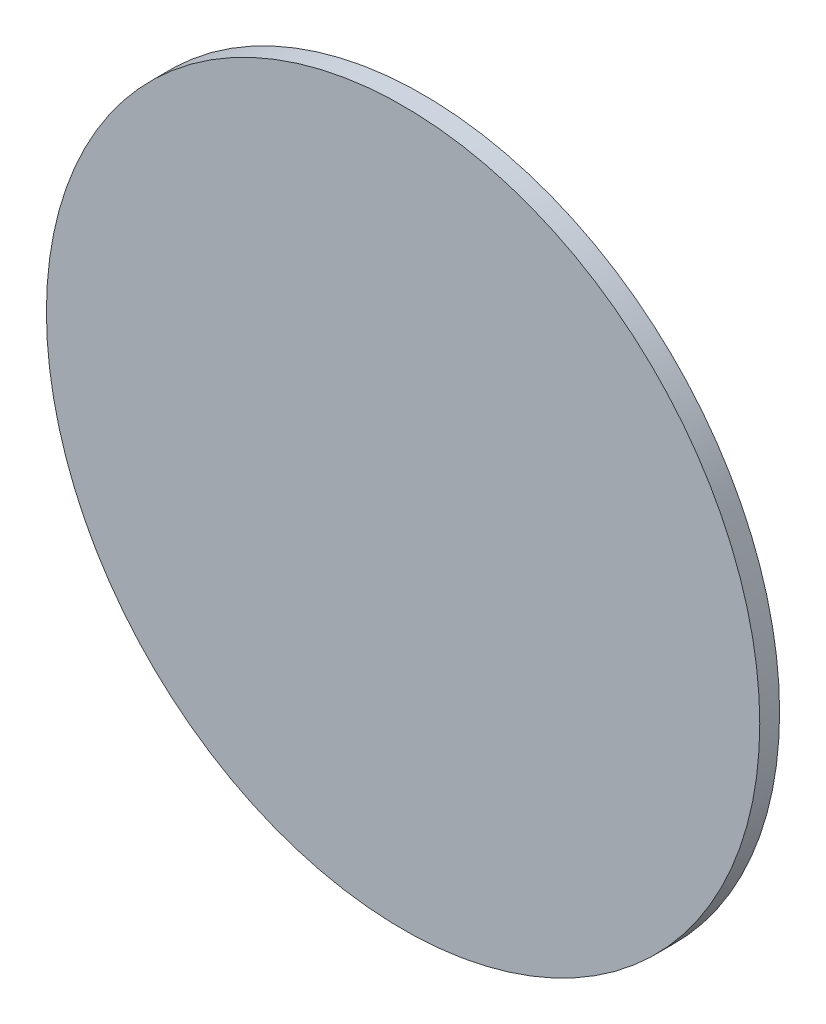
from build123d import *

# Parameters (mm, degrees)
SKETCH1_R           = 90
SKETCH1_R_2         = 1.5
BOSS_EXTRUDE1_DEPTH = 5
BOSS_EXTRUDE2_START = -5
SKETCH2_R           = 90
BOSS_EXTRUDE2_DEPTH = 5


with BuildPart() as part:
    # Sketch1 → Boss-Extrude1 (new body)
    with BuildSketch(Plane.XY):
        with Locations((589.5, 151)):
            Circle(SKETCH1_R)
        with Locations((580.661165235, 224.838834765)):
            Circle(SKETCH1_R_2, mode=Mode.SUBTRACT)
        with Locations((589.5, 216)):
            Circle(SKETCH1_R_2, mode=Mode.SUBTRACT)
        with Locations((598.338834765, 207.161165235)):
            Circle(SKETCH1_R_2, mode=Mode.SUBTRACT)
        with Locations((606.448581044, 223.408867689)):
            Circle(SKETCH1_R_2, mode=Mode.SUBTRACT)
        with Locations((611.731309316, 212.080020351)):
            Circle(SKETCH1_R_2, mode=Mode.SUBTRACT)
        with Locations((617.014037588, 200.751173013)):
            Circle(SKETCH1_R_2, mode=Mode.SUBTRACT)
        with Locations((630.191747845, 213.245322529)):
            Circle(SKETCH1_R_2, mode=Mode.SUBTRACT)
        with Locations((631.28119463, 200.792888803)):
            Circle(SKETCH1_R_2, mode=Mode.SUBTRACT)
        with Locations((632.370641414, 188.340455077)):
            Circle(SKETCH1_R_2, mode=Mode.SUBTRACT)
        with Locations((649.02688931, 195.574072829)):
            Circle(SKETCH1_R_2, mode=Mode.SUBTRACT)
        with Locations((645.791651246, 183.5)):
            Circle(SKETCH1_R_2, mode=Mode.SUBTRACT)
        with Locations((642.556413182, 171.425927171)):
            Circle(SKETCH1_R_2, mode=Mode.SUBTRACT)
        with Locations((660.6822094, 172.526532102)):
            Circle(SKETCH1_R_2, mode=Mode.SUBTRACT)
        with Locations((653.512503946, 162.287131548)):
            Circle(SKETCH1_R_2, mode=Mode.SUBTRACT)
        with Locations((646.342798491, 152.047730995)):
            Circle(SKETCH1_R_2, mode=Mode.SUBTRACT)
        with Locations((663.751904499, 146.882573906)):
            Circle(SKETCH1_R_2, mode=Mode.SUBTRACT)
        with Locations((653.512503946, 139.712868452)):
            Circle(SKETCH1_R_2, mode=Mode.SUBTRACT)
        with Locations((643.273103392, 132.543162997)):
            Circle(SKETCH1_R_2, mode=Mode.SUBTRACT)
        with Locations((657.865724075, 121.735238064)):
            Circle(SKETCH1_R_2, mode=Mode.SUBTRACT)
        with Locations((645.791651246, 118.5)):
            Circle(SKETCH1_R_2, mode=Mode.SUBTRACT)
        with Locations((633.717578417, 115.264761936)):
            Circle(SKETCH1_R_2, mode=Mode.SUBTRACT)
        with Locations((643.733628356, 100.117664413)):
            Circle(SKETCH1_R_2, mode=Mode.SUBTRACT)
        with Locations((631.28119463, 101.207111197)):
            Circle(SKETCH1_R_2, mode=Mode.SUBTRACT)
        with Locations((618.828760903, 102.296557982)):
            Circle(SKETCH1_R_2, mode=Mode.SUBTRACT)
        with Locations((623.060156654, 84.637251377)):
            Circle(SKETCH1_R_2, mode=Mode.SUBTRACT)
        with Locations((611.731309316, 89.919979649)):
            Circle(SKETCH1_R_2, mode=Mode.SUBTRACT)
        with Locations((600.402461978, 95.202707921)):
            Circle(SKETCH1_R_2, mode=Mode.SUBTRACT)
        with Locations((598.338834765, 77.161165235)):
            Circle(SKETCH1_R_2, mode=Mode.SUBTRACT)
        with Locations((589.5, 86)):
            Circle(SKETCH1_R_2, mode=Mode.SUBTRACT)
        with Locations((580.661165235, 94.838834765)):
            Circle(SKETCH1_R_2, mode=Mode.SUBTRACT)
        with Locations((572.551418956, 78.591132311)):
            Circle(SKETCH1_R_2, mode=Mode.SUBTRACT)
        with Locations((567.268690684, 89.919979649)):
            Circle(SKETCH1_R_2, mode=Mode.SUBTRACT)
        with Locations((561.985962412, 101.248826987)):
            Circle(SKETCH1_R_2, mode=Mode.SUBTRACT)
        with Locations((548.808252155, 88.754677471)):
            Circle(SKETCH1_R_2, mode=Mode.SUBTRACT)
        with Locations((547.71880537, 101.207111197)):
            Circle(SKETCH1_R_2, mode=Mode.SUBTRACT)
        with Locations((546.629358586, 113.659544923)):
            Circle(SKETCH1_R_2, mode=Mode.SUBTRACT)
        with Locations((529.97311069, 106.425927171)):
            Circle(SKETCH1_R_2, mode=Mode.SUBTRACT)
        with Locations((533.208348754, 118.5)):
            Circle(SKETCH1_R_2, mode=Mode.SUBTRACT)
        with Locations((536.443586818, 130.574072829)):
            Circle(SKETCH1_R_2, mode=Mode.SUBTRACT)
        with Locations((518.3177906, 129.473467898)):
            Circle(SKETCH1_R_2, mode=Mode.SUBTRACT)
        with Locations((525.487496054, 139.712868452)):
            Circle(SKETCH1_R_2, mode=Mode.SUBTRACT)
        with Locations((532.657201509, 149.952269005)):
            Circle(SKETCH1_R_2, mode=Mode.SUBTRACT)
        with Locations((515.248095501, 155.117426094)):
            Circle(SKETCH1_R_2, mode=Mode.SUBTRACT)
        with Locations((525.487496054, 162.287131548)):
            Circle(SKETCH1_R_2, mode=Mode.SUBTRACT)
        with Locations((535.726896608, 169.456837003)):
            Circle(SKETCH1_R_2, mode=Mode.SUBTRACT)
        with Locations((521.134275925, 180.264761936)):
            Circle(SKETCH1_R_2, mode=Mode.SUBTRACT)
        with Locations((533.208348754, 183.5)):
            Circle(SKETCH1_R_2, mode=Mode.SUBTRACT)
        with Locations((545.282421583, 186.735238064)):
            Circle(SKETCH1_R_2, mode=Mode.SUBTRACT)
        with Locations((535.266371644, 201.882335587)):
            Circle(SKETCH1_R_2, mode=Mode.SUBTRACT)
        with Locations((547.71880537, 200.792888803)):
            Circle(SKETCH1_R_2, mode=Mode.SUBTRACT)
        with Locations((560.171239097, 199.703442018)):
            Circle(SKETCH1_R_2, mode=Mode.SUBTRACT)
        with Locations((555.939843346, 217.362748623)):
            Circle(SKETCH1_R_2, mode=Mode.SUBTRACT)
        with Locations((567.268690684, 212.080020351)):
            Circle(SKETCH1_R_2, mode=Mode.SUBTRACT)
        with Locations((578.597538022, 206.797292079)):
            Circle(SKETCH1_R_2, mode=Mode.SUBTRACT)
    extrude(amount=BOSS_EXTRUDE1_DEPTH)

    # Sketch2 → Boss-Extrude2 (add)
    with BuildSketch(Plane.XY.offset(5).offset(BOSS_EXTRUDE2_START)):
        with Locations((589.5, 151)):
            Circle(SKETCH2_R)
    extrude(amount=BOSS_EXTRUDE2_DEPTH)


solid = part.part
